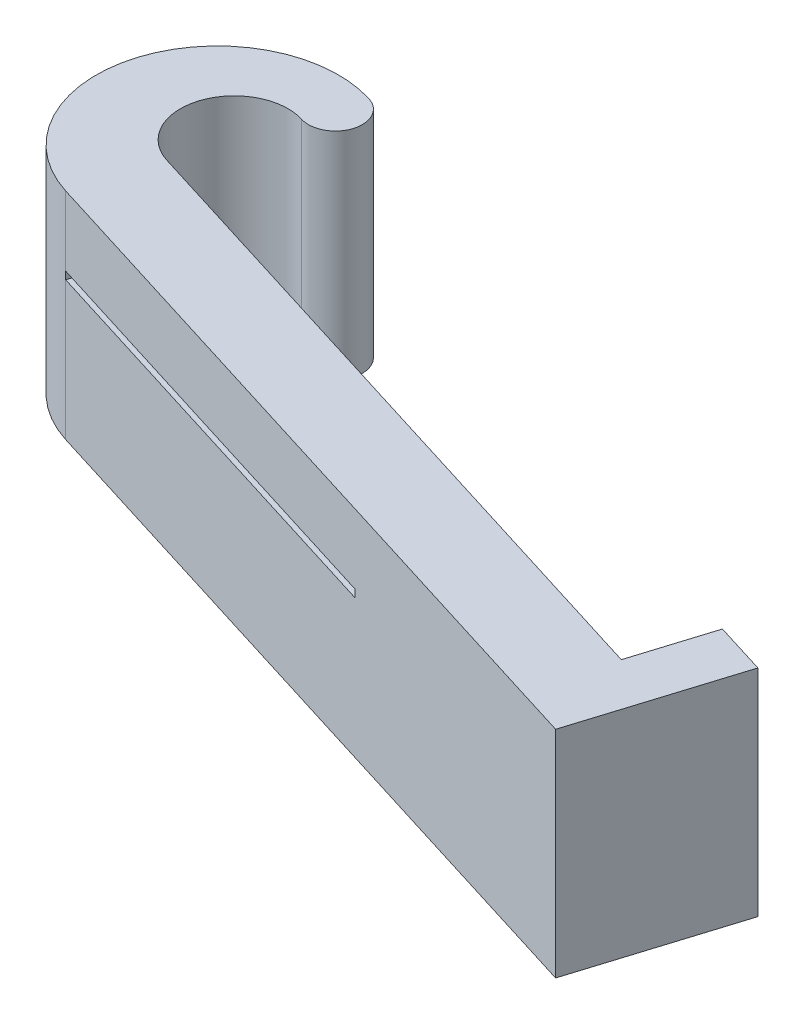
from build123d import *

# Parameters (mm, degrees)
BOSS_EXTRUDE1_DEPTH = 50.8
SKETCH3_W           = 103.793513641
SKETCH3_H           = 1.78121028
CUT_EXTRUDE1_DEPTH  = 2.54


with BuildPart() as part:
    # Sketch1 → Boss-Extrude1 (new body)
    with BuildSketch(Plane(origin=(0, -33.456799282, 0), x_dir=(1, 0, 0), z_dir=(0, 1, 0))):
        with BuildLine():
            Line((-527.50657757, -80.842567675), (-695.232596141, -28.656691245))
            ThreePointArc((-695.232596141, -28.656691245), (-714.028086723, 7.11747239), (-678.253923088, 25.912962972))
            ThreePointArc((-678.253923088, 25.912962972), (-674.077147403, 17.963148831), (-682.026961544, 13.786373146))
            ThreePointArc((-682.026961544, 13.786373146), (-697.926589826, 5.432821776), (-689.573038456, -10.466806506))
            Line((-689.573038456, -10.466806506), (-533.973609712, -58.87964448))
            Line((-533.973609712, -58.87964448), (-528.314052027, -40.689759741))
            Line((-528.314052027, -40.689759741), (-516.187462201, -44.462798197))
            Line((-516.187462201, -44.462798197), (-527.50657757, -80.842567675))
        make_face()
    extrude(amount=BOSS_EXTRUDE1_DEPTH)

    # Sketch3 → Cut-Extrude1 (cut)
    with BuildSketch(Plane(origin=(-69.492010407, 0, 223.348136035), x_dir=(0.9548495925978474, 0, 0.2970896422222171), z_dir=(-0.29708964222221707, 0, 0.9548495925978473))):
        with Locations((-603.432198215, 0.071200718)):
            Rectangle(SKETCH3_W, SKETCH3_H)
    extrude(amount=-CUT_EXTRUDE1_DEPTH, mode=Mode.SUBTRACT)


solid = part.part
